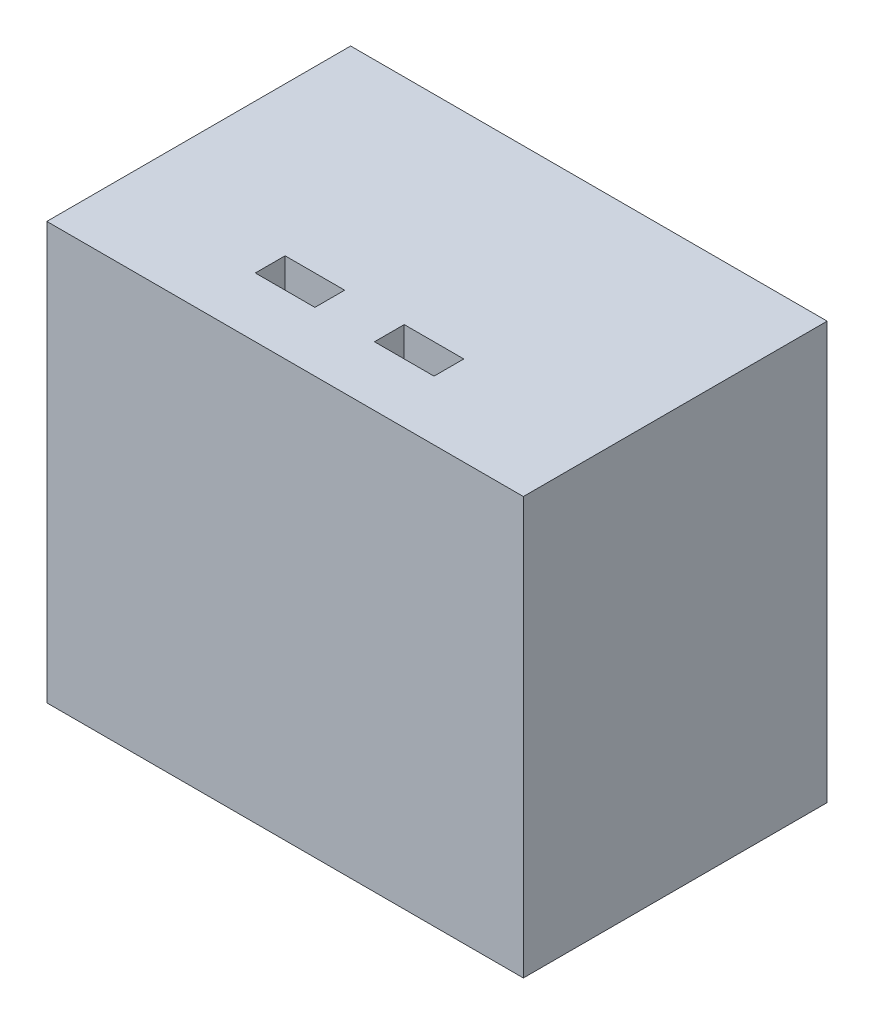
from build123d import *

# Parameters (mm, degrees)
SKETCH2_W           = 80
SKETCH2_H           = 70
BOSS_EXTRUDE1_DEPTH = 51
SKETCH3_W           = 10
SKETCH3_H           = 5
CUT_EXTRUDE1_DEPTH  = 10


with BuildPart() as part:
    # Sketch2 → Boss-Extrude1 (new body)
    with BuildSketch(Plane.XY):
        Rectangle(SKETCH2_W, SKETCH2_H)
    extrude(amount=BOSS_EXTRUDE1_DEPTH)

    # Sketch3 → Cut-Extrude1 (cut)
    with BuildSketch(Plane(origin=(0, 35, 0), x_dir=(1, 0, 0), z_dir=(0, 1, 0))):
        with Locations((-10, -38.5)):
            Rectangle(SKETCH3_W, SKETCH3_H)
        with Locations((10, -38.5)):
            Rectangle(SKETCH3_W, SKETCH3_H)
    extrude(amount=-CUT_EXTRUDE1_DEPTH, mode=Mode.SUBTRACT)


solid = part.part
